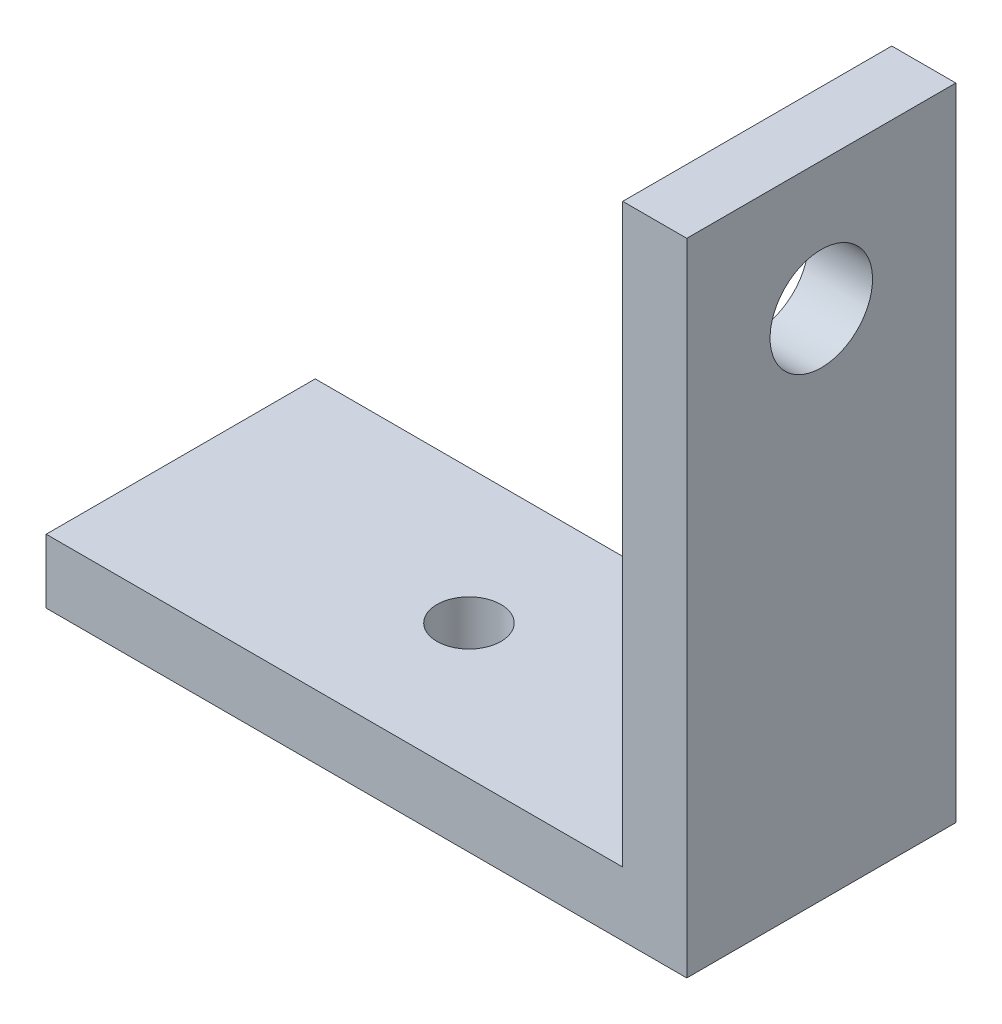
from build123d import *

# Parameters (mm, degrees)
BOSS_EXTRUDE1_DEPTH = 21
SKETCH3_R           = 4
CUT_EXTRUDE1_DEPTH  = 71.46985171
SKETCH4_R           = 2.5
CUT_EXTRUDE2_DEPTH  = 74.763134424


with BuildPart() as part:
    # Sketch2 → Boss-Extrude1 (new body)
    with BuildSketch(Plane.XY):
        Polygon((0, 0), (0, 50), (-5, 50), (-5, 5), (-50, 5), (-50, 0), align=None)
    extrude(amount=BOSS_EXTRUDE1_DEPTH)

    # Sketch3 → Cut-Extrude1 (cut, through all)
    with BuildSketch(Plane.ZY.offset(5)):
        with Locations(Location((10.5, 40, 0), (0, 0, 270))):
            Circle(SKETCH3_R)
    extrude(amount=-CUT_EXTRUDE1_DEPTH, mode=Mode.SUBTRACT)

    # Sketch4 → Cut-Extrude2 (cut, through all)
    with BuildSketch(Plane(origin=(0, 0, 0), x_dir=(1, 0, 0), z_dir=(0, 1, 0))):
        with Locations((-27.5, -10.5)):
            Circle(SKETCH4_R)
    extrude(amount=CUT_EXTRUDE2_DEPTH, mode=Mode.SUBTRACT)


solid = part.part
